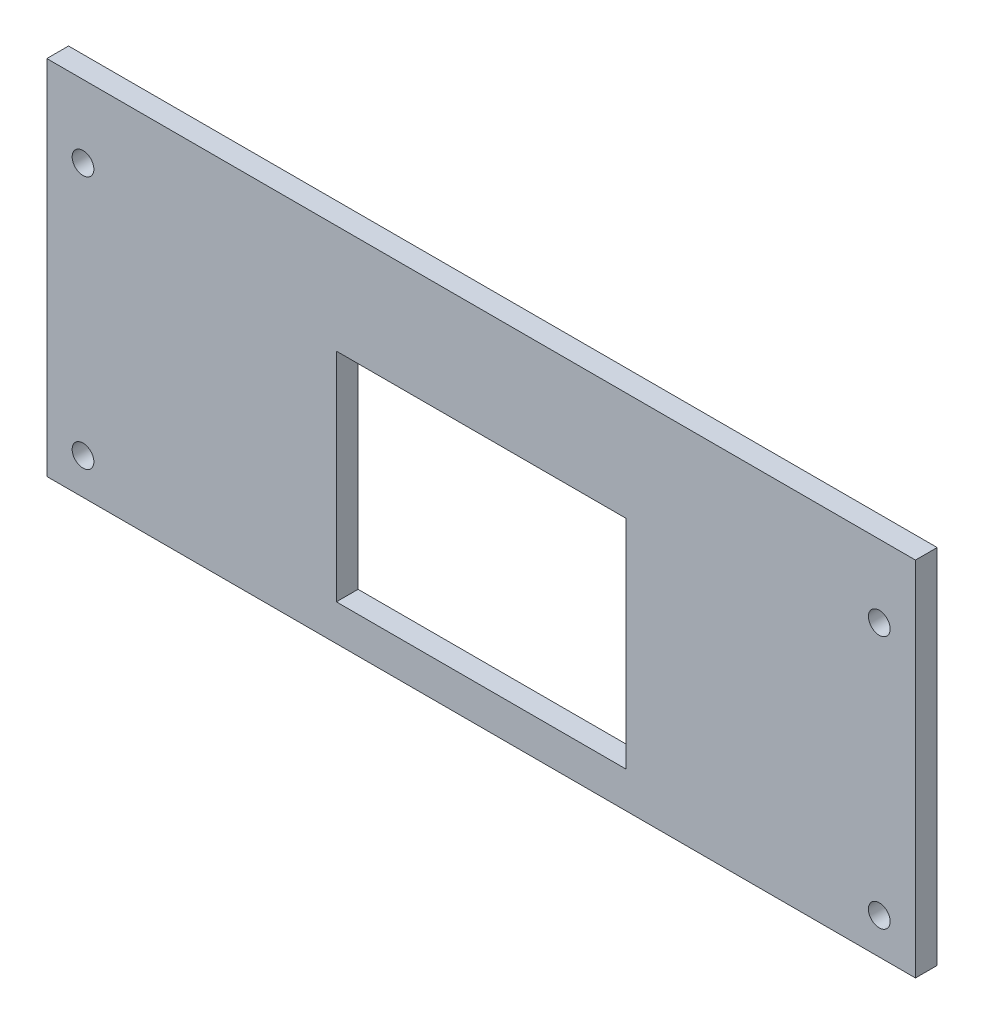
from build123d import *

# Parameters (mm, degrees)
ESQUISSE1_W        = 120
ESQUISSE1_H        = 50
ESQUISSE1_R        = 1.5
ESQUISSE1_W_2      = 40
ESQUISSE1_H_2      = 30
BOSS_EXTRU_1_DEPTH = 3


with BuildPart() as part:
    # Esquisse1 → Boss.-Extru.1 (new body)
    with BuildSketch(Plane.XY):
        Rectangle(ESQUISSE1_W, ESQUISSE1_H)
        with Locations((-55, 15)):
            Circle(ESQUISSE1_R, mode=Mode.SUBTRACT)
        with Locations((-55, -20)):
            Circle(ESQUISSE1_R, mode=Mode.SUBTRACT)
        with Locations(Location((55, -20, 0), (0, 0, 180))):
            Circle(ESQUISSE1_R, mode=Mode.SUBTRACT)
        with Locations(Location((55, 15, 0), (0, 0, 180))):
            Circle(ESQUISSE1_R, mode=Mode.SUBTRACT)
        with Locations((0, -5)):
            Rectangle(ESQUISSE1_W_2, ESQUISSE1_H_2, mode=Mode.SUBTRACT)
    extrude(amount=BOSS_EXTRU_1_DEPTH)


solid = part.part
